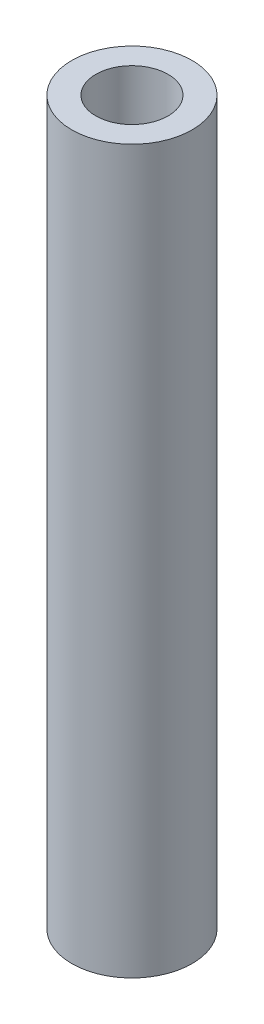
from build123d import *

# Parameters (mm, degrees)
SKETCH_1_R      = 2.5
SKETCH_1_R_2    = 1.5
EXTRUDE_1_DEPTH = 30


with BuildPart() as part:
    # 草图1 → 凸台-拉伸1 (new body)
    with BuildSketch(Plane(origin=(0, 0, 0), x_dir=(1, 0, 0), z_dir=(0, 1, 0))):
        with Locations(Location((0, 0, 0), (0, 0, 270))):
            Circle(SKETCH_1_R)
        with Locations(Location((0, 0, 0), (0, 0, 270))):
            Circle(SKETCH_1_R_2, mode=Mode.SUBTRACT)
    extrude(amount=EXTRUDE_1_DEPTH)


solid = part.part
